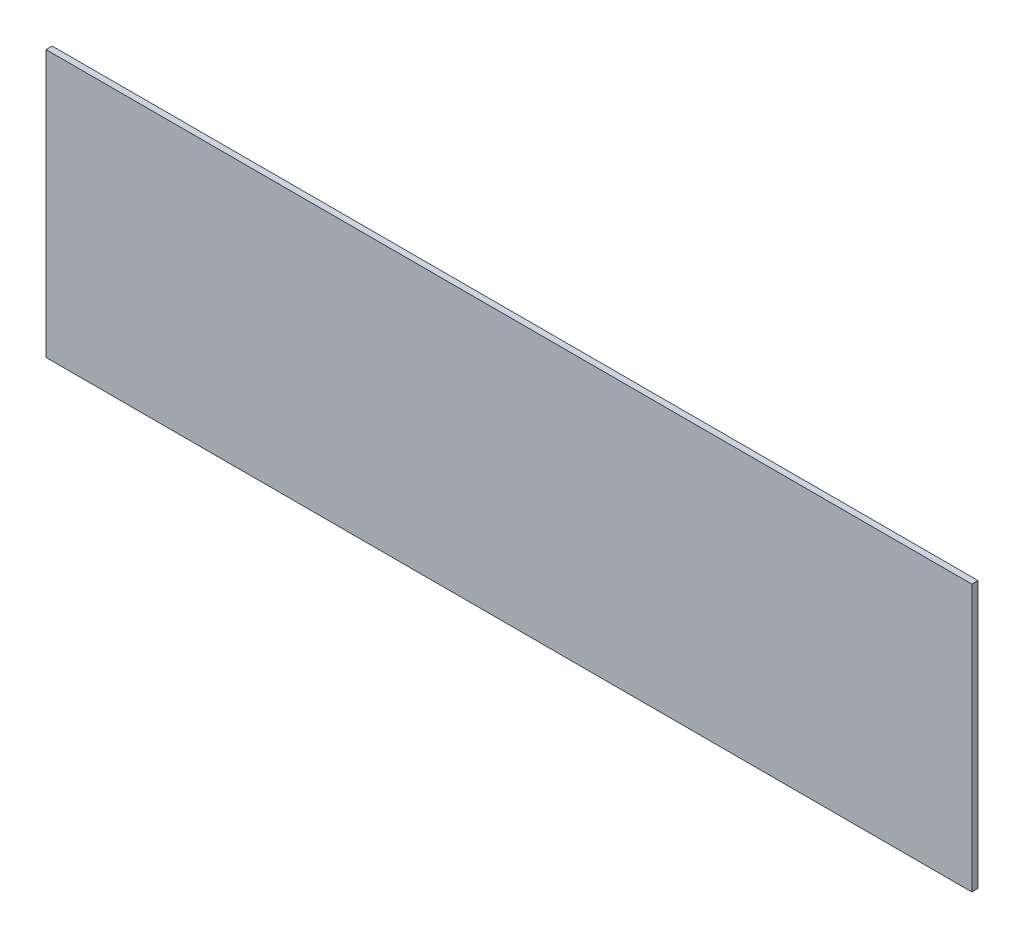
from build123d import *

# Parameters (mm, degrees)
SKETCH1_W           = 1500
SKETCH1_H           = 432
BOSS_EXTRUDE1_DEPTH = 10


with BuildPart() as part:
    # Sketch1 → Boss-Extrude1 (new body)
    with BuildSketch(Plane.XY):
        Rectangle(SKETCH1_W, SKETCH1_H)
    extrude(amount=BOSS_EXTRUDE1_DEPTH)


solid = part.part
